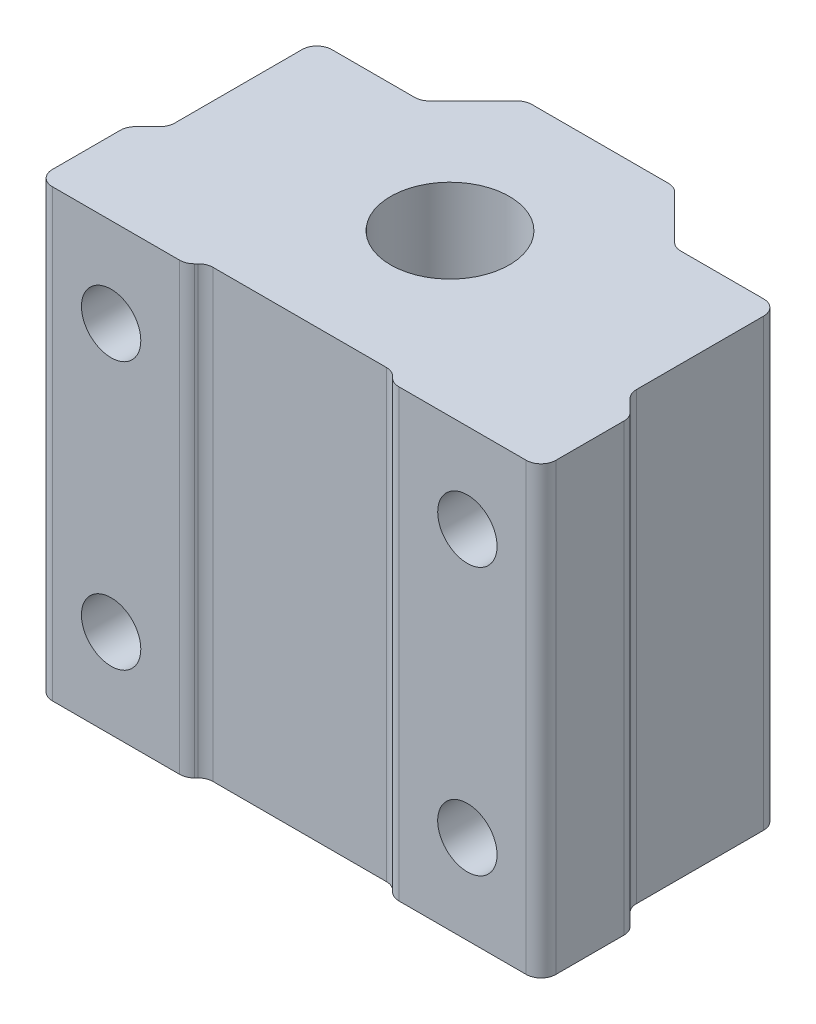
from build123d import *

# Parameters (mm, degrees)
SKETCH_1_R          = 4
EXTRUDE_1_DEPTH     = 30
SKETCH_3_R          = 2
CUT_EXTRUDE_1_DEPTH = 100


with BuildPart() as part:
    # 草图1 → 凸台-拉伸1 (new body)
    with BuildSketch(Plane(origin=(0, 0, 0), x_dir=(1, 0, 0), z_dir=(0, 1, 0))):
        with BuildLine():
            Line((-40.566755923, 0.414213562), (-31.980969486, 0.414213562))
            ThreePointArc((-31.980969486, 0.414213562), (-31.598286053, 0.49033403), (-31.273862704, 0.707106781))
            Line((-31.273862704, 0.707106781), (-31.152542361, 0.828427125))
            ThreePointArc((-31.152542361, 0.828427125), (-30.828119012, 1.045199876), (-30.44543558, 1.121320344))
            Line((-30.44543558, 1.121320344), (-18.761824504, 1.121320344))
            ThreePointArc((-18.761824504, 1.121320344), (-18.379141072, 1.045199876), (-18.054717723, 0.828427125))
            Line((-18.054717723, 0.828427125), (-17.933397379, 0.707106781))
            ThreePointArc((-17.933397379, 0.707106781), (-17.60897403, 0.49033403), (-17.226290598, 0.414213562))
            Line((-17.226290598, 0.414213562), (-8.64050416, 0.414213562))
            ThreePointArc((-8.64050416, 0.414213562), (-7.933397379, 0.707106781), (-7.64050416, 1.414213562))
            Line((-7.64050416, 1.414213562), (-7.64050416, 6))
            ThreePointArc((-7.64050416, 6), (-7.716624628, 6.382683432), (-7.933397379, 6.707106781))
            Line((-7.933397379, 6.707106781), (-8.761824504, 7.535533906))
            ThreePointArc((-8.761824504, 7.535533906), (-8.978597255, 7.859957255), (-9.054717723, 8.242640687))
            Line((-9.054717723, 8.242640687), (-9.054717723, 16.828427125))
            ThreePointArc((-9.054717723, 16.828427125), (-9.347610942, 17.535533906), (-10.054717723, 17.828427125))
            Line((-10.054717723, 17.828427125), (-15.64050416, 17.828427125))
            ThreePointArc((-15.64050416, 17.828427125), (-16.023187593, 17.904547592), (-16.347610942, 18.121320344))
            Line((-16.347610942, 18.121320344), (-19.29735841, 21.071067812))
            ThreePointArc((-19.29735841, 21.071067812), (-19.621781759, 21.287840563), (-20.004465191, 21.363961031))
            Line((-20.004465191, 21.363961031), (-29.202794893, 21.363961031))
            ThreePointArc((-29.202794893, 21.363961031), (-29.585478325, 21.287840563), (-29.909901674, 21.071067812))
            Line((-29.909901674, 21.071067812), (-32.859649142, 18.121320344))
            ThreePointArc((-32.859649142, 18.121320344), (-33.184072491, 17.904547592), (-33.566755923, 17.828427125))
            Line((-33.566755923, 17.828427125), (-39.152542361, 17.828427125))
            ThreePointArc((-39.152542361, 17.828427125), (-39.859649142, 17.535533906), (-40.152542361, 16.828427125))
            Line((-40.152542361, 16.828427125), (-40.152542361, 8.242640687))
            ThreePointArc((-40.152542361, 8.242640687), (-40.228662828, 7.859957255), (-40.44543558, 7.535533906))
            Line((-40.44543558, 7.535533906), (-41.273862704, 6.707106781))
            ThreePointArc((-41.273862704, 6.707106781), (-41.490635456, 6.382683432), (-41.566755923, 6))
            Line((-41.566755923, 6), (-41.566755923, 1.414213562))
            ThreePointArc((-41.566755923, 1.414213562), (-41.273862704, 0.707106781), (-40.566755923, 0.414213562))
        make_face()
        with Locations(Location((-24.603630042, 11.242640687, 0), (0, 0, 270))):
            Circle(SKETCH_1_R, mode=Mode.SUBTRACT)
    extrude(amount=EXTRUDE_1_DEPTH)

    # 草图3 → 切除-拉伸1 (cut)
    with BuildSketch(Plane.XY.offset(-0.414213562)):
        with Locations((-12.603630042, 6)):
            Circle(SKETCH_3_R)
        with Locations((-36.603630042, 6)):
            Circle(SKETCH_3_R)
        with Locations((-36.603630042, 24)):
            Circle(SKETCH_3_R)
        with Locations((-12.603630042, 24)):
            Circle(SKETCH_3_R)
    extrude(amount=-CUT_EXTRUDE_1_DEPTH, mode=Mode.SUBTRACT)


solid = part.part
